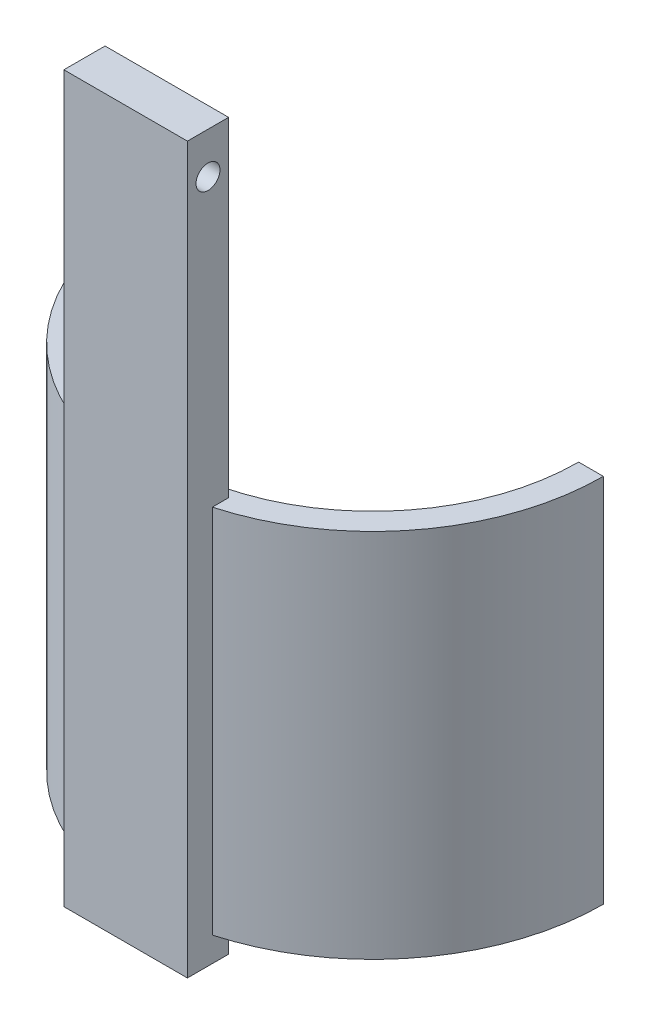
from build123d import *

# Parameters (mm, degrees)
REVOLVE_1_ANGLE      = 180
EXTRUDE_2_DEPTH      = 40
EXTRUDE_2_DEPTH_BACK = 48
SKETCH_3_R           = 1.45
CUT_EXTRUDE_1_DEPTH  = 40


with BuildPart() as part:
    # 草图1 → 旋转1 (revolve)
    with BuildSketch(Plane.XY):
        Polygon((0.445759369, 0), (4.86726431, -2.823603424), (1.86726431, -2.823603424), (-2.554240631, 0), (-2.554240631, 45), (0.445759369, 45), align=None)
    revolve(axis=Axis((25.445759369, 0, 0), (0, 1, 0)), revolution_arc=REVOLVE_1_ANGLE)

    # 草图2 → 凸台-拉伸2 (add, two sides: drawn at the far end of the back side and taken through both)
    with BuildSketch(Plane(origin=(0, 45, 0), x_dir=(1, 0, 0), z_dir=(0, 1, 0)).offset(-EXTRUDE_2_DEPTH_BACK)):
        with BuildLine():
            Line((32.945759369, -30), (32.945759369, -26.97684192))
            ThreePointArc((32.945759369, -26.97684192), (25.445759369, -28), (17.945759369, -26.97684192))
            Line((17.945759369, -26.97684192), (17.945759369, -30))
            Line((17.945759369, -30), (32.945759369, -30))
        make_face()
        with BuildLine():
            Line((32.945759369, -25), (25.445759369, -25))
            Line((25.445759369, -25), (17.945759369, -25))
            Line((17.945759369, -25), (17.945759369, -26.97684192))
            ThreePointArc((17.945759369, -26.97684192), (25.445759369, -28), (32.945759369, -26.97684192))
            Line((32.945759369, -26.97684192), (32.945759369, -25))
        make_face()
    extrude(amount=EXTRUDE_2_DEPTH + EXTRUDE_2_DEPTH_BACK)

    # 草图3 → 切除-拉伸1 (cut)
    with BuildSketch(Plane(origin=(32.945759369, 0, 0), x_dir=(0, 0, -1), z_dir=(1, 0, 0))):
        with Locations((-27.5, 80)):
            Circle(SKETCH_3_R)
    extrude(amount=-CUT_EXTRUDE_1_DEPTH, mode=Mode.SUBTRACT)


solid = part.part
